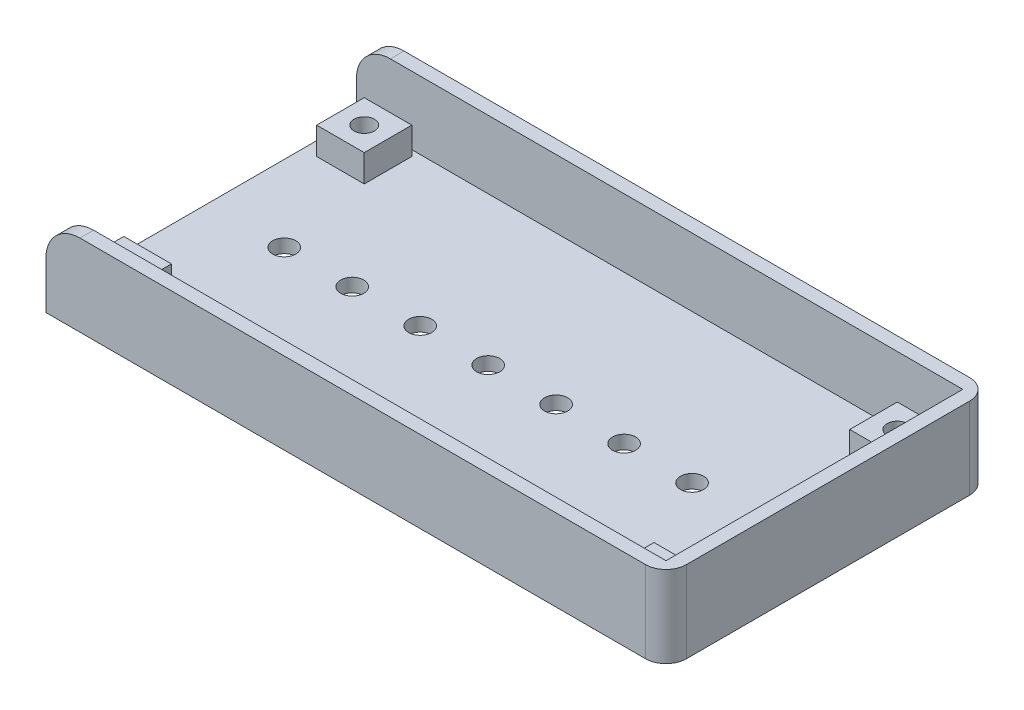
from build123d import *

# Parameters (mm, degrees)
BOSS_EXTRUDE1_DEPTH = 2
BOSS_EXTRUDE2_DEPTH = 10
SKETCH3_W           = 7
SKETCH3_H           = 7
SKETCH3_R           = 1.5
BOSS_EXTRUDE3_DEPTH = 4
FILLET1_R           = 5
FILLET2_R           = 3


with BuildPart() as part:
    # Sketch1 → Boss-Extrude1 (new body)
    with BuildSketch(Plane(origin=(0, 0, 0), x_dir=(1, 0, 0), z_dir=(0, 1, 0))):
        with BuildLine():
            Line((-2, 21.835), (-2, -2))
            Line((-2, -2), (89.22, -2))
            Line((89.22, -2), (89.22, 21.835))
            Line((89.22, 21.835), (80.92, 21.835))
            ThreePointArc((80.92, 21.835), (79.22, 20.135), (77.52, 21.835))
            Line((77.52, 21.835), (70.92, 21.835))
            ThreePointArc((70.92, 21.835), (69.22, 20.135), (67.52, 21.835))
            Line((67.52, 21.835), (60.92, 21.835))
            ThreePointArc((60.92, 21.835), (59.22, 20.135), (57.52, 21.835))
            Line((57.52, 21.835), (50.92, 21.835))
            ThreePointArc((50.92, 21.835), (49.22, 20.135), (47.52, 21.835))
            Line((47.52, 21.835), (40.92, 21.835))
            ThreePointArc((40.92, 21.835), (39.22, 20.135), (37.52, 21.835))
            Line((37.52, 21.835), (30.92, 21.835))
            ThreePointArc((30.92, 21.835), (29.22, 20.135), (27.52, 21.835))
            Line((27.52, 21.835), (20.92, 21.835))
            ThreePointArc((20.92, 21.835), (19.22, 20.135), (17.52, 21.835))
            Line((17.52, 21.835), (10.92, 21.835))
            ThreePointArc((10.92, 21.835), (9.22, 20.135), (7.52, 21.835))
            Line((7.52, 21.835), (-2, 21.835))
        make_face()
        with BuildLine():
            Line((-2, 45.67), (-2, 21.835))
            Line((-2, 21.835), (7.52, 21.835))
            ThreePointArc((7.52, 21.835), (9.22, 23.535), (10.92, 21.835))
            Line((10.92, 21.835), (17.52, 21.835))
            ThreePointArc((17.52, 21.835), (19.22, 23.535), (20.92, 21.835))
            Line((20.92, 21.835), (27.52, 21.835))
            ThreePointArc((27.52, 21.835), (29.22, 23.535), (30.92, 21.835))
            Line((30.92, 21.835), (37.52, 21.835))
            ThreePointArc((37.52, 21.835), (39.22, 23.535), (40.92, 21.835))
            Line((40.92, 21.835), (47.52, 21.835))
            ThreePointArc((47.52, 21.835), (49.22, 23.535), (50.92, 21.835))
            Line((50.92, 21.835), (57.52, 21.835))
            ThreePointArc((57.52, 21.835), (59.22, 23.535), (60.92, 21.835))
            Line((60.92, 21.835), (67.52, 21.835))
            ThreePointArc((67.52, 21.835), (69.22, 23.535), (70.92, 21.835))
            Line((70.92, 21.835), (77.52, 21.835))
            ThreePointArc((77.52, 21.835), (79.22, 23.535), (80.92, 21.835))
            Line((80.92, 21.835), (89.22, 21.835))
            Line((89.22, 21.835), (89.22, 45.67))
            Line((89.22, 45.67), (-2, 45.67))
        make_face()
    extrude(amount=BOSS_EXTRUDE1_DEPTH)

    # Sketch2 → Boss-Extrude2 (add)
    with BuildSketch(Plane(origin=(0, 2, 0), x_dir=(1, 0, 0), z_dir=(0, 1, 0))):
        Polygon((-2, 0), (-2, -2), (89.22, -2), (89.22, 45.67), (-2, 45.67), (-2, 43.67), (0, 43.67), (87.22, 43.67), (87.22, 0), (0, 0), align=None)
    extrude(amount=BOSS_EXTRUDE2_DEPTH)

    # Sketch3 → Boss-Extrude3 (add)
    # profile 1 of 4: a face of its own
    with BuildSketch(Plane(origin=(0, 2, 0), x_dir=(1, 0, 0), z_dir=(0, 1, 0))):
        with Locations((81.51878701, 39.735)):
            Rectangle(SKETCH3_W, SKETCH3_H)
        with Locations(Location((81.51878701, 39.735, 0), (0, 0, 270))):
            Circle(SKETCH3_R, mode=Mode.SUBTRACT)
    # profile 2 of 4: a face of its own
    with BuildSketch(Plane(origin=(0, 2, 0), x_dir=(1, 0, 0), z_dir=(0, 1, 0))):
        with Locations((81.51878701, 3.935)):
            Rectangle(SKETCH3_W, SKETCH3_H)
        with Locations(Location((81.51878701, 3.935, 0), (0, 0, 90))):
            Circle(SKETCH3_R, mode=Mode.SUBTRACT)
    # profile 3 of 4: a face of its own
    with BuildSketch(Plane(origin=(0, 2, 0), x_dir=(1, 0, 0), z_dir=(0, 1, 0))):
        with Locations((3.52, 39.3)):
            Rectangle(SKETCH3_W, SKETCH3_H)
        with Locations((3.52, 39.3)):
            Circle(SKETCH3_R, mode=Mode.SUBTRACT)
    # profile 4 of 4: a face of its own
    with BuildSketch(Plane(origin=(0, 2, 0), x_dir=(1, 0, 0), z_dir=(0, 1, 0))):
        with Locations((3.51878701, 3.935)):
            Rectangle(SKETCH3_W, SKETCH3_H)
        with Locations(Location((3.51878701, 3.935, 0), (0, 0, 180))):
            Circle(SKETCH3_R, mode=Mode.SUBTRACT)
    extrude(amount=BOSS_EXTRUDE3_DEPTH)

    # Fillet1
    fillet1_edges = [part.edges().sort_by_distance(p)[0] for p in [
        (-2, 12, -44.67),
        (-2, 12, 1),
    ]]
    fillet(fillet1_edges, radius=FILLET1_R)

    # Fillet2
    fillet2_edges = [part.edges().sort_by_distance(p)[0] for p in [
        (89.22, 6, -45.67),
        (89.22, 6, 2),
    ]]
    fillet(fillet2_edges, radius=FILLET2_R)


solid = part.part
